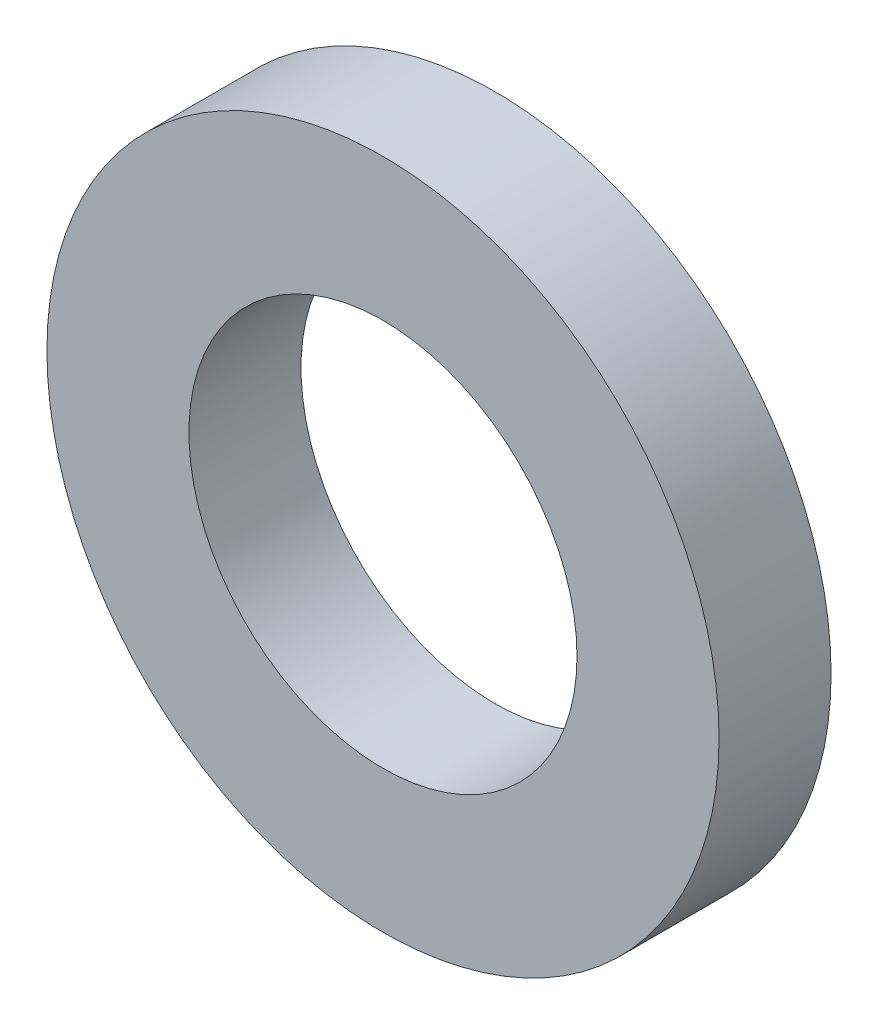
from build123d import *

# Parameters (mm, degrees)
SKETCH4_R           = 19.05
BOSS_EXTRUDE1_DEPTH = 3.175
SKETCH2_R           = 10.9982
CUT_EXTRUDE1_DEPTH  = 12.7


with BuildPart() as part:
    # Sketch4 → Boss-Extrude1 (new, symmetric)
    with BuildSketch(Plane.XY):
        Circle(SKETCH4_R)
    extrude(amount=BOSS_EXTRUDE1_DEPTH, both=True)

    # Sketch2 → Cut-Extrude1 (cut, symmetric)
    with BuildSketch(Plane.XY):
        Circle(SKETCH2_R)
    extrude(amount=CUT_EXTRUDE1_DEPTH, both=True, mode=Mode.SUBTRACT)


solid = part.part
